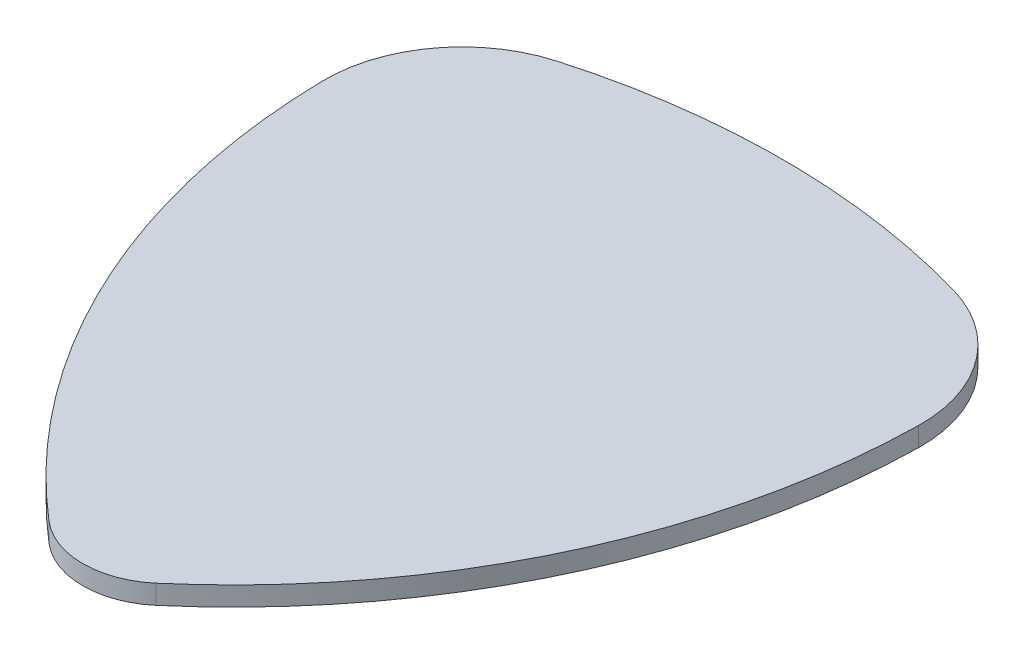
from build123d import *

# Parameters (mm, degrees)
BOSS_EXTRUDE1_DEPTH = 0.7
FILLET1_R           = 5
FILLET2_R           = 5
FILLET3_R           = 3
SCALE1_SCALE        = 1.2


with BuildPart() as part:
    # Sketch1 → Boss-Extrude1 (new body)
    with BuildSketch(Plane(origin=(0, 0, 0), x_dir=(1, 0, 0), z_dir=(0, 1, 0))):
        with BuildLine():
            ThreePointArc((0, 0), (10.651659547, 2.257529417), (21.303319094, 0))
            ThreePointArc((21.303319094, 0), (19.324245754, -13.485354588), (10.651659547, -24))
            ThreePointArc((10.651659547, -24), (1.979073341, -13.485354588), (0, 0))
        make_face()
    extrude(amount=BOSS_EXTRUDE1_DEPTH)

    # Fillet1
    fillet1_edges = [part.edges().sort_by_distance(p)[0] for p in [
        (21.303319094, 0.35, 0),
    ]]
    fillet(fillet1_edges, radius=FILLET1_R)

    # Fillet2
    fillet2_edges = [part.edges().sort_by_distance(p)[0] for p in [
        (0, 0.35, 0),
    ]]
    fillet(fillet2_edges, radius=FILLET2_R)

    # Fillet3
    fillet3_edges = [part.edges().sort_by_distance(p)[0] for p in [
        (10.651659547, 0.35, 24),
    ]]
    fillet(fillet3_edges, radius=FILLET3_R)


with BuildPart() as part_1:
    # Scale1: scaled about (10.651659546, 0.35, 8.789033062)
    add(part.part.scale(SCALE1_SCALE).moved(Location((-2.130331909, -0.07, -1.757806612))))


solid = part_1.part
